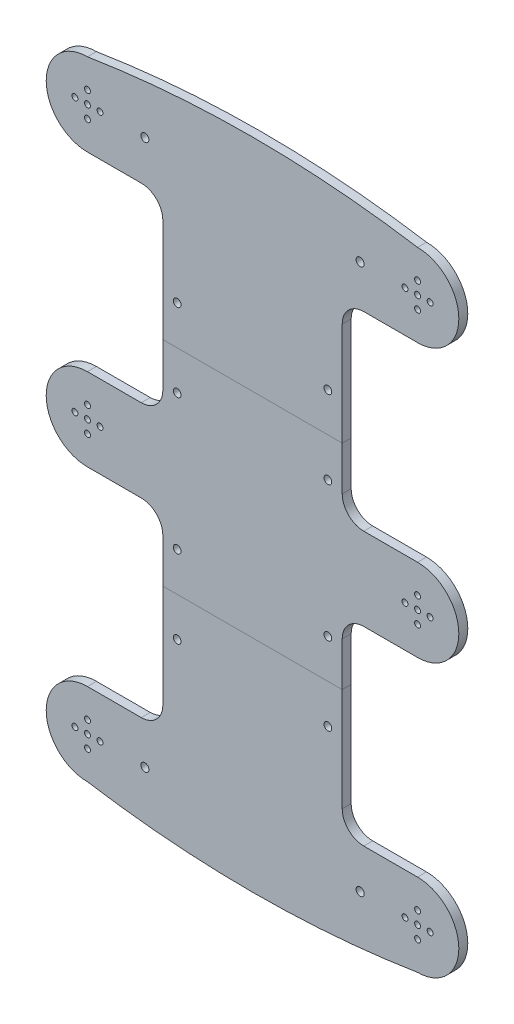
from build123d import *

# Parameters (mm, degrees)
SZKIC1_R                    = 1.65
DODANIE_WYCI_GNI_CIE1_DEPTH = 5
SZKIC3_R                    = 2.25
WYTNIJ_WYCI_GNI_CIE1_DEPTH  = 216.603683599
SZKIC4_R                    = 2.15
WYTNIJ_WYCI_GNI_CIE2_DEPTH  = 216.603683599
PODZIEL1_SURFACE_1_1_BACK   = 432.12
PODZIEL1_SURFACE_1_1_DEPTH  = 864.24
PODZIEL1_SURFACE_1_2_BACK   = 432.12
PODZIEL1_SURFACE_1_2_DEPTH  = 864.24
PODZIEL1_SURFACE_2_3_BACK   = 432.12
PODZIEL1_SURFACE_2_3_DEPTH  = 864.24
PODZIEL1_SURFACE_2_4_BACK   = 432.12
PODZIEL1_SURFACE_2_4_DEPTH  = 864.24


with BuildPart() as part:
    # Szkic1 → Dodanie-wyciągnięcie1 (new body)
    with BuildSketch(Plane.XY):
        with BuildLine():
            Line((-50, -116.998971504), (-50, -35.001028496))
            ThreePointArc((-50, -35.001028496), (-53.514718626, -26.515747122), (-62, -23.001028496))
            Line((-62, -23.001028496), (-92, -23.001028496))
            ThreePointArc((-92, -23.001028496), (-115.001028496, 0), (-92, 23.001028496))
            Line((-92, 23.001028496), (-62, 23.001028496))
            ThreePointArc((-62, 23.001028496), (-53.514718626, 26.515747122), (-50, 35.001028496))
            Line((-50, 35.001028496), (-50, 116.998971504))
            ThreePointArc((-50, 116.998971504), (-53.514718626, 125.484252878), (-62, 128.998971504))
            Line((-62, 128.998971504), (-92, 128.998971504))
            ThreePointArc((-92, 128.998971504), (-115.001028496, 152), (-92, 175.001028496))
            ThreePointArc((-92, 175.001028496), (0, 182.303899646), (92, 175.001028496))
            ThreePointArc((92, 175.001028496), (115.001028496, 152), (92, 128.998971504))
            Line((92, 128.998971504), (62, 128.998971504))
            ThreePointArc((62, 128.998971504), (53.514718626, 125.484252878), (50, 116.998971504))
            Line((50, 116.998971504), (50, 35.001028496))
            ThreePointArc((50, 35.001028496), (53.514718626, 26.515747122), (62, 23.001028496))
            Line((62, 23.001028496), (92, 23.001028496))
            ThreePointArc((92, 23.001028496), (115.001028496, 0), (92, -23.001028496))
            Line((92, -23.001028496), (62, -23.001028496))
            ThreePointArc((62, -23.001028496), (53.514718626, -26.515747122), (50, -35.001028496))
            Line((50, -35.001028496), (50, -116.998971504))
            ThreePointArc((50, -116.998971504), (53.514718626, -125.484252878), (62, -128.998971504))
            Line((62, -128.998971504), (92, -128.998971504))
            ThreePointArc((92, -128.998971504), (115.001028496, -152), (92, -175.001028496))
            ThreePointArc((92, -175.001028496), (0, -182.303899646), (-92, -175.001028496))
            ThreePointArc((-92, -175.001028496), (-115.001028496, -152), (-92, -128.998971504))
            Line((-92, -128.998971504), (-62, -128.998971504))
            ThreePointArc((-62, -128.998971504), (-53.514718626, -125.484252878), (-50, -116.998971504))
        make_face()
        with Locations((-92, 7.001028496)):
            Circle(SZKIC1_R, mode=Mode.SUBTRACT)
        with Locations((-84.998971504, 0)):
            Circle(SZKIC1_R, mode=Mode.SUBTRACT)
        with Locations((-92, -7.001028496)):
            Circle(SZKIC1_R, mode=Mode.SUBTRACT)
        with Locations((-99.001028496, 0)):
            Circle(SZKIC1_R, mode=Mode.SUBTRACT)
        with Locations(Location((-92, 159.001028496, 0), (0, 0, 180))):
            Circle(SZKIC1_R, mode=Mode.SUBTRACT)
        with Locations(Location((-99.001028496, 152, 0), (0, 0, 180))):
            Circle(SZKIC1_R, mode=Mode.SUBTRACT)
        with Locations(Location((-92, 144.998971504, 0), (0, 0, 180))):
            Circle(SZKIC1_R, mode=Mode.SUBTRACT)
        with Locations(Location((-84.998971504, 152, 0), (0, 0, 180))):
            Circle(SZKIC1_R, mode=Mode.SUBTRACT)
        with Locations(Location((-92, -144.998971504, 0), (0, 0, 180))):
            Circle(SZKIC1_R, mode=Mode.SUBTRACT)
        with Locations(Location((-99.001028496, -152, 0), (0, 0, 180))):
            Circle(SZKIC1_R, mode=Mode.SUBTRACT)
        with Locations(Location((-92, -159.001028496, 0), (0, 0, 180))):
            Circle(SZKIC1_R, mode=Mode.SUBTRACT)
        with Locations(Location((-84.998971504, -152, 0), (0, 0, 180))):
            Circle(SZKIC1_R, mode=Mode.SUBTRACT)
        with Locations((84.998971504, -152)):
            Circle(SZKIC1_R, mode=Mode.SUBTRACT)
        with Locations((92, -159.001028496)):
            Circle(SZKIC1_R, mode=Mode.SUBTRACT)
        with Locations((99.001028496, -152)):
            Circle(SZKIC1_R, mode=Mode.SUBTRACT)
        with Locations((92, -144.998971504)):
            Circle(SZKIC1_R, mode=Mode.SUBTRACT)
        with Locations(Location((99.001028496, 0, 0), (0, 0, 180))):
            Circle(SZKIC1_R, mode=Mode.SUBTRACT)
        with Locations(Location((92, -7.001028496, 0), (0, 0, 180))):
            Circle(SZKIC1_R, mode=Mode.SUBTRACT)
        with Locations(Location((84.998971504, 0, 0), (0, 0, 180))):
            Circle(SZKIC1_R, mode=Mode.SUBTRACT)
        with Locations(Location((92, 7.001028496, 0), (0, 0, 180))):
            Circle(SZKIC1_R, mode=Mode.SUBTRACT)
        with Locations((84.998971504, 152)):
            Circle(SZKIC1_R, mode=Mode.SUBTRACT)
        with Locations((92, 144.998971504)):
            Circle(SZKIC1_R, mode=Mode.SUBTRACT)
        with Locations((99.001028496, 152)):
            Circle(SZKIC1_R, mode=Mode.SUBTRACT)
        with Locations((92, 159.001028496)):
            Circle(SZKIC1_R, mode=Mode.SUBTRACT)
        with Locations((-92, 0)):
            Circle(SZKIC1_R, mode=Mode.SUBTRACT)
        with Locations(Location((-92, -152, 0), (0, 0, 180))):
            Circle(SZKIC1_R, mode=Mode.SUBTRACT)
        with Locations(Location((-92, 152, 0), (0, 0, 180))):
            Circle(SZKIC1_R, mode=Mode.SUBTRACT)
        with Locations((92, -152)):
            Circle(SZKIC1_R, mode=Mode.SUBTRACT)
        with Locations((92, 152)):
            Circle(SZKIC1_R, mode=Mode.SUBTRACT)
        with Locations(Location((92, 0, 0), (0, 0, 180))):
            Circle(SZKIC1_R, mode=Mode.SUBTRACT)
    extrude(amount=DODANIE_WYCI_GNI_CIE1_DEPTH)

    # Szkic3 → Wytnij-wyciągnięcie1 (cut, through all)
    with BuildSketch(Plane.XY.offset(5)):
        with Locations((-60, -152)):
            Circle(SZKIC3_R)
        with Locations(Location((60, -152, 0), (0, 0, 180))):
            Circle(SZKIC3_R)
        with Locations((60, 152)):
            Circle(SZKIC3_R)
        with Locations(Location((-60, 152, 0), (0, 0, 180))):
            Circle(SZKIC3_R)
    extrude(amount=-WYTNIJ_WYCI_GNI_CIE1_DEPTH, mode=Mode.SUBTRACT)

    # Szkic4 → Wytnij-wyciągnięcie2 (cut, through all)
    with BuildSketch(Plane.XY.offset(5)):
        with Locations((-42, -37.748971504)):
            Circle(SZKIC4_R)
        with Locations(Location((-42, -81.248971504, 0), (0, 0, 180))):
            Circle(SZKIC4_R)
        with Locations((42, -81.248971504)):
            Circle(SZKIC4_R)
        with Locations(Location((42, -37.748971504, 0), (0, 0, 180))):
            Circle(SZKIC4_R)
        with Locations((42, 37.748971504)):
            Circle(SZKIC4_R)
        with Locations(Location((42, 81.248971504, 0), (0, 0, 180))):
            Circle(SZKIC4_R)
        with Locations((-42, 81.248971504)):
            Circle(SZKIC4_R)
        with Locations(Location((-42, 37.748971504, 0), (0, 0, 180))):
            Circle(SZKIC4_R)
    extrude(amount=-WYTNIJ_WYCI_GNI_CIE2_DEPTH, mode=Mode.SUBTRACT)


with BuildPart() as body_2:
    # Podziel1: the piece behind the surface
    add(part.part)
    # Podziel1 surface 1: a surface, the sketch's curves swept straight by 864.24 mm
    with BuildLine(Plane.XY.offset(5).offset(-PODZIEL1_SURFACE_1_1_BACK), mode=Mode.PRIVATE) as podziel1_surface_1_1_path:
        Line((-70.966955214, -59.501028496), (115.533234257, -59.501028496))
    podziel1_surface_1_1 = Shell.extrude(podziel1_surface_1_1_path.wire(), (0 * PODZIEL1_SURFACE_1_1_DEPTH, 0 * PODZIEL1_SURFACE_1_1_DEPTH, 1 * PODZIEL1_SURFACE_1_1_DEPTH))
    split(bisect_by=podziel1_surface_1_1, keep=Keep.BOTTOM)


with BuildPart() as part_1:
    add(part.part)

    # Podziel1: split by a surface, the side it looks to stays
    # Podziel1 surface 1: a surface, the sketch's curves swept straight by 864.24 mm
    with BuildLine(Plane.XY.offset(5).offset(-PODZIEL1_SURFACE_1_2_BACK), mode=Mode.PRIVATE) as podziel1_surface_1_2_path:
        Line((-70.966955214, -59.501028496), (115.533234257, -59.501028496))
    podziel1_surface_1_2 = Shell.extrude(podziel1_surface_1_2_path.wire(), (0 * PODZIEL1_SURFACE_1_2_DEPTH, 0 * PODZIEL1_SURFACE_1_2_DEPTH, 1 * PODZIEL1_SURFACE_1_2_DEPTH))
    split(bisect_by=podziel1_surface_1_2, keep=Keep.TOP)


with BuildPart() as body_3:
    # Podziel1 2: the piece behind the surface
    add(part_1.part)
    # Podziel1 surface 2: a surface, the sketch's curves swept straight by 864.24 mm
    with BuildLine(Plane.XY.offset(5).offset(-PODZIEL1_SURFACE_2_3_BACK), mode=Mode.PRIVATE) as podziel1_surface_2_3_path:
        Line((-70.966955214, 59.501028496), (98.578671578, 59.501028496))
    podziel1_surface_2_3 = Shell.extrude(podziel1_surface_2_3_path.wire(), (0 * PODZIEL1_SURFACE_2_3_DEPTH, 0 * PODZIEL1_SURFACE_2_3_DEPTH, 1 * PODZIEL1_SURFACE_2_3_DEPTH))
    split(bisect_by=podziel1_surface_2_3, keep=Keep.BOTTOM)


with BuildPart() as part_2:
    add(part_1.part)

    # Podziel1 2: split by a surface, the side it looks to stays
    # Podziel1 surface 2: a surface, the sketch's curves swept straight by 864.24 mm
    with BuildLine(Plane.XY.offset(5).offset(-PODZIEL1_SURFACE_2_4_BACK), mode=Mode.PRIVATE) as podziel1_surface_2_4_path:
        Line((-70.966955214, 59.501028496), (98.578671578, 59.501028496))
    podziel1_surface_2_4 = Shell.extrude(podziel1_surface_2_4_path.wire(), (0 * PODZIEL1_SURFACE_2_4_DEPTH, 0 * PODZIEL1_SURFACE_2_4_DEPTH, 1 * PODZIEL1_SURFACE_2_4_DEPTH))
    split(bisect_by=podziel1_surface_2_4, keep=Keep.TOP)


solid = Compound([body_2.part, body_3.part, part_2.part])
